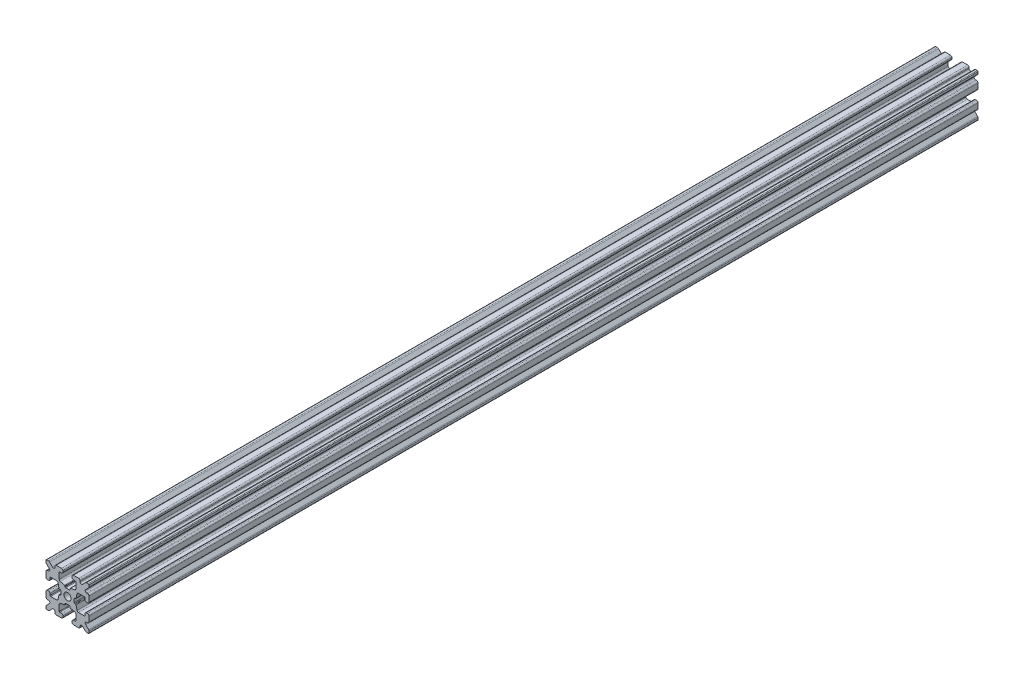
from build123d import *

# Parameters (mm, degrees)
CROQUIS1_R              = 1.25
SALIENTE_EXTRUIR1_DEPTH = 300
CROQUIS2_R              = 1.25
SALIENTE_EXTRUIR2_DEPTH = 40
CROQUIS3_W              = 34.056367391
CROQUIS3_H              = 19.601200986
CORTAR_EXTRUIR1_DEPTH   = 30


with BuildPart() as part:
    # Croquis1 → Saliente-Extruir1 (new body)
    with BuildSketch(Plane(origin=(0, 0, -150), x_dir=(-1, 0, 0), z_dir=(0, 0, -1))):
        with BuildLine():
            Line((-2.9, -5.9), (-2.9, -3.80033659))
            ThreePointArc((-2.9, -3.80033659), (-2.790306203, -3.487828881), (-2.509355728, -3.312441801))
            Line((-2.509355728, -3.312441801), (-0.981757709, -2.970049142))
            ThreePointArc((-0.981757709, -2.970049142), (-0.869377519, -2.89989431), (-0.8255, -2.774891226))
            Line((-0.8255, -2.774891226), (-0.8255, -2.5470646))
            ThreePointArc((-0.8255, -2.5470646), (-0.766921356, -2.405643244), (-0.6255, -2.3470646))
            Line((-0.6255, -2.3470646), (0.6255, -2.3470646))
            ThreePointArc((0.6255, -2.3470646), (0.766921356, -2.405643244), (0.8255, -2.5470646))
            Line((0.8255, -2.5470646), (0.8255, -2.774891226))
            ThreePointArc((0.8255, -2.774891226), (0.869377519, -2.89989431), (0.981757709, -2.970049142))
            Line((0.981757709, -2.970049142), (2.509355728, -3.312441801))
            ThreePointArc((2.509355728, -3.312441801), (2.790306203, -3.487828881), (2.9, -3.80033659))
            Line((2.9, -3.80033659), (2.9, -5.9))
            ThreePointArc((2.9, -5.9), (2.841421356, -6.041421356), (2.7, -6.1))
            Line((2.7, -6.1), (2.1, -6.1))
            ThreePointArc((2.1, -6.1), (1.746446609, -6.246446609), (1.6, -6.6))
            Line((1.6, -6.6), (1.6, -7))
            ThreePointArc((1.6, -7), (1.746446609, -7.353553391), (2.1, -7.5))
            Line((2.1, -7.5), (3.9, -7.5))
            ThreePointArc((3.9, -7.5), (4.253553391, -7.353553391), (4.4, -7))
            Line((4.4, -7), (4.4, -6.667766953))
            ThreePointArc((4.4, -6.667766953), (4.708658284, -6.205827187), (5.253553391, -6.314213562))
            Line((5.253553391, -6.314213562), (6.292893219, -7.353553391))
            ThreePointArc((6.292893219, -7.353553391), (6.455104893, -7.461939766), (6.646446609, -7.5))
            Line((6.646446609, -7.5), (7.25, -7.5))
            ThreePointArc((7.25, -7.5), (7.426776695, -7.426776695), (7.5, -7.25))
            Line((7.5, -7.25), (7.5, -6.646446609))
            ThreePointArc((7.5, -6.646446609), (7.461939766, -6.455104893), (7.353553391, -6.292893219))
            Line((7.353553391, -6.292893219), (6.314213562, -5.253553391))
            ThreePointArc((6.314213562, -5.253553391), (6.205827187, -4.708658284), (6.667766953, -4.4))
            Line((6.667766953, -4.4), (7, -4.4))
            ThreePointArc((7, -4.4), (7.353553391, -4.253553391), (7.5, -3.9))
            Line((7.5, -3.9), (7.5, -2.1))
            ThreePointArc((7.5, -2.1), (7.353553391, -1.746446609), (7, -1.6))
            Line((7, -1.6), (6.6, -1.6))
            ThreePointArc((6.6, -1.6), (6.246446609, -1.746446609), (6.1, -2.1))
            Line((6.1, -2.1), (6.1, -2.7))
            ThreePointArc((6.1, -2.7), (6.041421356, -2.841421356), (5.9, -2.9))
            Line((5.9, -2.9), (3.80033659, -2.9))
            ThreePointArc((3.80033659, -2.9), (3.487828881, -2.790306203), (3.312441801, -2.509355728))
            Line((3.312441801, -2.509355728), (2.970049142, -0.981757709))
            ThreePointArc((2.970049142, -0.981757709), (2.89989431, -0.869377519), (2.774891226, -0.8255))
            Line((2.774891226, -0.8255), (2.5470646, -0.8255))
            ThreePointArc((2.5470646, -0.8255), (2.405643244, -0.766921356), (2.3470646, -0.6255))
            Line((2.3470646, -0.6255), (2.3470646, 0.6255))
            ThreePointArc((2.3470646, 0.6255), (2.405643244, 0.766921356), (2.5470646, 0.8255))
            Line((2.5470646, 0.8255), (2.774891226, 0.8255))
            ThreePointArc((2.774891226, 0.8255), (2.89989431, 0.869377519), (2.970049142, 0.981757709))
            Line((2.970049142, 0.981757709), (3.312441801, 2.509355728))
            ThreePointArc((3.312441801, 2.509355728), (3.487828881, 2.790306203), (3.80033659, 2.9))
            Line((3.80033659, 2.9), (5.9, 2.9))
            ThreePointArc((5.9, 2.9), (6.041421356, 2.841421356), (6.1, 2.7))
            Line((6.1, 2.7), (6.1, 2.1))
            ThreePointArc((6.1, 2.1), (6.246446609, 1.746446609), (6.6, 1.6))
            Line((6.6, 1.6), (7, 1.6))
            ThreePointArc((7, 1.6), (7.353553391, 1.746446609), (7.5, 2.1))
            Line((7.5, 2.1), (7.5, 3.9))
            ThreePointArc((7.5, 3.9), (7.353553391, 4.253553391), (7, 4.4))
            Line((7, 4.4), (6.667766953, 4.4))
            ThreePointArc((6.667766953, 4.4), (6.205827187, 4.708658284), (6.314213562, 5.253553391))
            Line((6.314213562, 5.253553391), (7.353553391, 6.292893219))
            ThreePointArc((7.353553391, 6.292893219), (7.461939766, 6.455104893), (7.5, 6.646446609))
            Line((7.5, 6.646446609), (7.5, 7.25))
            ThreePointArc((7.5, 7.25), (7.426776695, 7.426776695), (7.25, 7.5))
            Line((7.25, 7.5), (6.646446609, 7.5))
            ThreePointArc((6.646446609, 7.5), (6.455104893, 7.461939766), (6.292893219, 7.353553391))
            Line((6.292893219, 7.353553391), (5.253553391, 6.314213562))
            ThreePointArc((5.253553391, 6.314213562), (4.708658284, 6.205827187), (4.4, 6.667766953))
            Line((4.4, 6.667766953), (4.4, 7))
            ThreePointArc((4.4, 7), (4.253553391, 7.353553391), (3.9, 7.5))
            Line((3.9, 7.5), (2.1, 7.5))
            ThreePointArc((2.1, 7.5), (1.746446609, 7.353553391), (1.6, 7))
            Line((1.6, 7), (1.6, 6.6))
            ThreePointArc((1.6, 6.6), (1.746446609, 6.246446609), (2.1, 6.1))
            Line((2.1, 6.1), (2.7, 6.1))
            ThreePointArc((2.7, 6.1), (2.841421356, 6.041421356), (2.9, 5.9))
            Line((2.9, 5.9), (2.9, 3.80033659))
            ThreePointArc((2.9, 3.80033659), (2.790306203, 3.487828881), (2.509355728, 3.312441801))
            Line((2.509355728, 3.312441801), (0.981757709, 2.970049142))
            ThreePointArc((0.981757709, 2.970049142), (0.869377519, 2.89989431), (0.8255, 2.774891226))
            Line((0.8255, 2.774891226), (0.8255, 2.5470646))
            ThreePointArc((0.8255, 2.5470646), (0.766921356, 2.405643244), (0.6255, 2.3470646))
            Line((0.6255, 2.3470646), (-0.6255, 2.3470646))
            ThreePointArc((-0.6255, 2.3470646), (-0.766921356, 2.405643244), (-0.8255, 2.5470646))
            Line((-0.8255, 2.5470646), (-0.8255, 2.774891226))
            ThreePointArc((-0.8255, 2.774891226), (-0.869377519, 2.89989431), (-0.981757709, 2.970049142))
            Line((-0.981757709, 2.970049142), (-2.509355728, 3.312441801))
            ThreePointArc((-2.509355728, 3.312441801), (-2.790306203, 3.487828881), (-2.9, 3.80033659))
            Line((-2.9, 3.80033659), (-2.9, 5.9))
            ThreePointArc((-2.9, 5.9), (-2.841421356, 6.041421356), (-2.7, 6.1))
            Line((-2.7, 6.1), (-2.1, 6.1))
            ThreePointArc((-2.1, 6.1), (-1.746446609, 6.246446609), (-1.6, 6.6))
            Line((-1.6, 6.6), (-1.6, 7))
            ThreePointArc((-1.6, 7), (-1.746446609, 7.353553391), (-2.1, 7.5))
            Line((-2.1, 7.5), (-3.9, 7.5))
            ThreePointArc((-3.9, 7.5), (-4.253553391, 7.353553391), (-4.4, 7))
            Line((-4.4, 7), (-4.4, 6.667766953))
            ThreePointArc((-4.4, 6.667766953), (-4.708658284, 6.205827187), (-5.253553391, 6.314213562))
            Line((-5.253553391, 6.314213562), (-6.292893219, 7.353553391))
            ThreePointArc((-6.292893219, 7.353553391), (-6.455104893, 7.461939766), (-6.646446609, 7.5))
            Line((-6.646446609, 7.5), (-7.25, 7.5))
            ThreePointArc((-7.25, 7.5), (-7.426776695, 7.426776695), (-7.5, 7.25))
            Line((-7.5, 7.25), (-7.5, 6.646446609))
            ThreePointArc((-7.5, 6.646446609), (-7.461939766, 6.455104893), (-7.353553391, 6.292893219))
            Line((-7.353553391, 6.292893219), (-6.314213562, 5.253553391))
            ThreePointArc((-6.314213562, 5.253553391), (-6.205827187, 4.708658284), (-6.667766953, 4.4))
            Line((-6.667766953, 4.4), (-7, 4.4))
            ThreePointArc((-7, 4.4), (-7.353553391, 4.253553391), (-7.5, 3.9))
            Line((-7.5, 3.9), (-7.5, 2.1))
            ThreePointArc((-7.5, 2.1), (-7.353553391, 1.746446609), (-7, 1.6))
            Line((-7, 1.6), (-6.6, 1.6))
            ThreePointArc((-6.6, 1.6), (-6.246446609, 1.746446609), (-6.1, 2.1))
            Line((-6.1, 2.1), (-6.1, 2.7))
            ThreePointArc((-6.1, 2.7), (-6.041421356, 2.841421356), (-5.9, 2.9))
            Line((-5.9, 2.9), (-3.80033659, 2.9))
            ThreePointArc((-3.80033659, 2.9), (-3.487828881, 2.790306203), (-3.312441801, 2.509355728))
            Line((-3.312441801, 2.509355728), (-2.970049142, 0.981757709))
            ThreePointArc((-2.970049142, 0.981757709), (-2.89989431, 0.869377519), (-2.774891226, 0.8255))
            Line((-2.774891226, 0.8255), (-2.5470646, 0.8255))
            ThreePointArc((-2.5470646, 0.8255), (-2.405643244, 0.766921356), (-2.3470646, 0.6255))
            Line((-2.3470646, 0.6255), (-2.3470646, -0.6255))
            ThreePointArc((-2.3470646, -0.6255), (-2.405643244, -0.766921356), (-2.5470646, -0.8255))
            Line((-2.5470646, -0.8255), (-2.774891226, -0.8255))
            ThreePointArc((-2.774891226, -0.8255), (-2.89989431, -0.869377519), (-2.970049142, -0.981757709))
            Line((-2.970049142, -0.981757709), (-3.312441801, -2.509355728))
            ThreePointArc((-3.312441801, -2.509355728), (-3.487828881, -2.790306203), (-3.80033659, -2.9))
            Line((-3.80033659, -2.9), (-5.9, -2.9))
            ThreePointArc((-5.9, -2.9), (-6.041421356, -2.841421356), (-6.1, -2.7))
            Line((-6.1, -2.7), (-6.1, -2.1))
            ThreePointArc((-6.1, -2.1), (-6.246446609, -1.746446609), (-6.6, -1.6))
            Line((-6.6, -1.6), (-7, -1.6))
            ThreePointArc((-7, -1.6), (-7.353553391, -1.746446609), (-7.5, -2.1))
            Line((-7.5, -2.1), (-7.5, -3.9))
            ThreePointArc((-7.5, -3.9), (-7.353553391, -4.253553391), (-7, -4.4))
            Line((-7, -4.4), (-6.667766953, -4.4))
            ThreePointArc((-6.667766953, -4.4), (-6.205827187, -4.708658284), (-6.314213562, -5.253553391))
            Line((-6.314213562, -5.253553391), (-7.353553391, -6.292893219))
            ThreePointArc((-7.353553391, -6.292893219), (-7.461939766, -6.455104893), (-7.5, -6.646446609))
            Line((-7.5, -6.646446609), (-7.5, -7.25))
            ThreePointArc((-7.5, -7.25), (-7.426776695, -7.426776695), (-7.25, -7.5))
            Line((-7.25, -7.5), (-6.646446609, -7.5))
            ThreePointArc((-6.646446609, -7.5), (-6.455104893, -7.461939766), (-6.292893219, -7.353553391))
            Line((-6.292893219, -7.353553391), (-5.253553391, -6.314213562))
            ThreePointArc((-5.253553391, -6.314213562), (-4.708658284, -6.205827187), (-4.4, -6.667766953))
            Line((-4.4, -6.667766953), (-4.4, -7))
            ThreePointArc((-4.4, -7), (-4.253553391, -7.353553391), (-3.9, -7.5))
            Line((-3.9, -7.5), (-2.1, -7.5))
            ThreePointArc((-2.1, -7.5), (-1.746446609, -7.353553391), (-1.6, -7))
            Line((-1.6, -7), (-1.6, -6.6))
            ThreePointArc((-1.6, -6.6), (-1.746446609, -6.246446609), (-2.1, -6.1))
            Line((-2.1, -6.1), (-2.7, -6.1))
            ThreePointArc((-2.7, -6.1), (-2.841421356, -6.041421356), (-2.9, -5.9))
        make_face()
        with Locations(Location((0, 0, 0), (0, 0, 180))):
            Circle(CROQUIS1_R, mode=Mode.SUBTRACT)
    extrude(amount=-SALIENTE_EXTRUIR1_DEPTH)

    # Croquis2 → Saliente-Extruir2 (add)
    with BuildSketch(Plane.XY.offset(150)):
        with BuildLine():
            Line((2.7, -6.1), (2.1, -6.1))
            ThreePointArc((2.1, -6.1), (1.746446609, -6.246446609), (1.6, -6.6))
            Line((1.6, -6.6), (1.6, -7))
            ThreePointArc((1.6, -7), (1.746446609, -7.353553391), (2.1, -7.5))
            Line((2.1, -7.5), (3.9, -7.5))
            ThreePointArc((3.9, -7.5), (4.253553391, -7.353553391), (4.4, -7))
            Line((4.4, -7), (4.4, -6.667766953))
            ThreePointArc((4.4, -6.667766953), (4.708658284, -6.205827187), (5.253553391, -6.314213562))
            Line((5.253553391, -6.314213562), (6.292893219, -7.353553391))
            ThreePointArc((6.292893219, -7.353553391), (6.455104893, -7.461939766), (6.646446609, -7.5))
            Line((6.646446609, -7.5), (7.25, -7.5))
            ThreePointArc((7.25, -7.5), (7.426776695, -7.426776695), (7.5, -7.25))
            Line((7.5, -7.25), (7.5, -6.646446609))
            ThreePointArc((7.5, -6.646446609), (7.461939766, -6.455104893), (7.353553391, -6.292893219))
            Line((7.353553391, -6.292893219), (6.314213562, -5.253553391))
            ThreePointArc((6.314213562, -5.253553391), (6.205827187, -4.708658284), (6.667766953, -4.4))
            Line((6.667766953, -4.4), (7, -4.4))
            ThreePointArc((7, -4.4), (7.353553391, -4.253553391), (7.5, -3.9))
            Line((7.5, -3.9), (7.5, -2.1))
            ThreePointArc((7.5, -2.1), (7.353553391, -1.746446609), (7, -1.6))
            Line((7, -1.6), (6.6, -1.6))
            ThreePointArc((6.6, -1.6), (6.246446609, -1.746446609), (6.1, -2.1))
            Line((6.1, -2.1), (6.1, -2.7))
            ThreePointArc((6.1, -2.7), (6.041421356, -2.841421356), (5.9, -2.9))
            Line((5.9, -2.9), (3.80033659, -2.9))
            ThreePointArc((3.80033659, -2.9), (3.487828881, -2.790306203), (3.312441801, -2.509355728))
            Line((3.312441801, -2.509355728), (2.970049142, -0.981757709))
            ThreePointArc((2.970049142, -0.981757709), (2.89989431, -0.869377519), (2.774891226, -0.8255))
            Line((2.774891226, -0.8255), (2.5470646, -0.8255))
            ThreePointArc((2.5470646, -0.8255), (2.405643244, -0.766921356), (2.3470646, -0.6255))
            Line((2.3470646, -0.6255), (2.3470646, 0.6255))
            ThreePointArc((2.3470646, 0.6255), (2.405643244, 0.766921356), (2.5470646, 0.8255))
            Line((2.5470646, 0.8255), (2.774891226, 0.8255))
            ThreePointArc((2.774891226, 0.8255), (2.89989431, 0.869377519), (2.970049142, 0.981757709))
            Line((2.970049142, 0.981757709), (3.312441801, 2.509355728))
            ThreePointArc((3.312441801, 2.509355728), (3.487828881, 2.790306203), (3.80033659, 2.9))
            Line((3.80033659, 2.9), (5.9, 2.9))
            ThreePointArc((5.9, 2.9), (6.041421356, 2.841421356), (6.1, 2.7))
            Line((6.1, 2.7), (6.1, 2.1))
            ThreePointArc((6.1, 2.1), (6.246446609, 1.746446609), (6.6, 1.6))
            Line((6.6, 1.6), (7, 1.6))
            ThreePointArc((7, 1.6), (7.353553391, 1.746446609), (7.5, 2.1))
            Line((7.5, 2.1), (7.5, 3.9))
            ThreePointArc((7.5, 3.9), (7.353553391, 4.253553391), (7, 4.4))
            Line((7, 4.4), (6.667766953, 4.4))
            ThreePointArc((6.667766953, 4.4), (6.205827187, 4.708658284), (6.314213562, 5.253553391))
            Line((6.314213562, 5.253553391), (7.353553391, 6.292893219))
            ThreePointArc((7.353553391, 6.292893219), (7.461939766, 6.455104893), (7.5, 6.646446609))
            Line((7.5, 6.646446609), (7.5, 7.25))
            ThreePointArc((7.5, 7.25), (7.426776695, 7.426776695), (7.25, 7.5))
            Line((7.25, 7.5), (6.646446609, 7.5))
            ThreePointArc((6.646446609, 7.5), (6.455104893, 7.461939766), (6.292893219, 7.353553391))
            Line((6.292893219, 7.353553391), (5.253553391, 6.314213562))
            ThreePointArc((5.253553391, 6.314213562), (4.708658284, 6.205827187), (4.4, 6.667766953))
            Line((4.4, 6.667766953), (4.4, 7))
            ThreePointArc((4.4, 7), (4.253553391, 7.353553391), (3.9, 7.5))
            Line((3.9, 7.5), (2.1, 7.5))
            ThreePointArc((2.1, 7.5), (1.746446609, 7.353553391), (1.6, 7))
            Line((1.6, 7), (1.6, 6.6))
            ThreePointArc((1.6, 6.6), (1.746446609, 6.246446609), (2.1, 6.1))
            Line((2.1, 6.1), (2.7, 6.1))
            ThreePointArc((2.7, 6.1), (2.841421356, 6.041421356), (2.9, 5.9))
            Line((2.9, 5.9), (2.9, 3.80033659))
            ThreePointArc((2.9, 3.80033659), (2.790306203, 3.487828881), (2.509355728, 3.312441801))
            Line((2.509355728, 3.312441801), (0.981757709, 2.970049142))
            ThreePointArc((0.981757709, 2.970049142), (0.869377519, 2.89989431), (0.8255, 2.774891226))
            Line((0.8255, 2.774891226), (0.8255, 2.5470646))
            ThreePointArc((0.8255, 2.5470646), (0.766921356, 2.405643244), (0.6255, 2.3470646))
            Line((0.6255, 2.3470646), (-0.6255, 2.3470646))
            ThreePointArc((-0.6255, 2.3470646), (-0.766921356, 2.405643244), (-0.8255, 2.5470646))
            Line((-0.8255, 2.5470646), (-0.8255, 2.774891226))
            ThreePointArc((-0.8255, 2.774891226), (-0.869377519, 2.89989431), (-0.981757709, 2.970049142))
            Line((-0.981757709, 2.970049142), (-2.509355728, 3.312441801))
            ThreePointArc((-2.509355728, 3.312441801), (-2.790306203, 3.487828881), (-2.9, 3.80033659))
            Line((-2.9, 3.80033659), (-2.9, 5.9))
            ThreePointArc((-2.9, 5.9), (-2.841421356, 6.041421356), (-2.7, 6.1))
            Line((-2.7, 6.1), (-2.1, 6.1))
            ThreePointArc((-2.1, 6.1), (-1.746446609, 6.246446609), (-1.6, 6.6))
            Line((-1.6, 6.6), (-1.6, 7))
            ThreePointArc((-1.6, 7), (-1.746446609, 7.353553391), (-2.1, 7.5))
            Line((-2.1, 7.5), (-3.9, 7.5))
            ThreePointArc((-3.9, 7.5), (-4.253553391, 7.353553391), (-4.4, 7))
            Line((-4.4, 7), (-4.4, 6.667766953))
            ThreePointArc((-4.4, 6.667766953), (-4.708658284, 6.205827187), (-5.253553391, 6.314213562))
            Line((-5.253553391, 6.314213562), (-6.292893219, 7.353553391))
            ThreePointArc((-6.292893219, 7.353553391), (-6.455104893, 7.461939766), (-6.646446609, 7.5))
            Line((-6.646446609, 7.5), (-7.25, 7.5))
            ThreePointArc((-7.25, 7.5), (-7.426776695, 7.426776695), (-7.5, 7.25))
            Line((-7.5, 7.25), (-7.5, 6.646446609))
            ThreePointArc((-7.5, 6.646446609), (-7.461939766, 6.455104893), (-7.353553391, 6.292893219))
            Line((-7.353553391, 6.292893219), (-6.314213562, 5.253553391))
            ThreePointArc((-6.314213562, 5.253553391), (-6.205827187, 4.708658284), (-6.667766953, 4.4))
            Line((-6.667766953, 4.4), (-7, 4.4))
            ThreePointArc((-7, 4.4), (-7.353553391, 4.253553391), (-7.5, 3.9))
            Line((-7.5, 3.9), (-7.5, 2.1))
            ThreePointArc((-7.5, 2.1), (-7.353553391, 1.746446609), (-7, 1.6))
            Line((-7, 1.6), (-6.6, 1.6))
            ThreePointArc((-6.6, 1.6), (-6.246446609, 1.746446609), (-6.1, 2.1))
            Line((-6.1, 2.1), (-6.1, 2.7))
            ThreePointArc((-6.1, 2.7), (-6.041421356, 2.841421356), (-5.9, 2.9))
            Line((-5.9, 2.9), (-3.80033659, 2.9))
            ThreePointArc((-3.80033659, 2.9), (-3.487828881, 2.790306203), (-3.312441801, 2.509355728))
            Line((-3.312441801, 2.509355728), (-2.970049142, 0.981757709))
            ThreePointArc((-2.970049142, 0.981757709), (-2.89989431, 0.869377519), (-2.774891226, 0.8255))
            Line((-2.774891226, 0.8255), (-2.5470646, 0.8255))
            ThreePointArc((-2.5470646, 0.8255), (-2.405643244, 0.766921356), (-2.3470646, 0.6255))
            Line((-2.3470646, 0.6255), (-2.3470646, -0.6255))
            ThreePointArc((-2.3470646, -0.6255), (-2.405643244, -0.766921356), (-2.5470646, -0.8255))
            Line((-2.5470646, -0.8255), (-2.774891226, -0.8255))
            ThreePointArc((-2.774891226, -0.8255), (-2.89989431, -0.869377519), (-2.970049142, -0.981757709))
            Line((-2.970049142, -0.981757709), (-3.312441801, -2.509355728))
            ThreePointArc((-3.312441801, -2.509355728), (-3.487828881, -2.790306203), (-3.80033659, -2.9))
            Line((-3.80033659, -2.9), (-5.9, -2.9))
            ThreePointArc((-5.9, -2.9), (-6.041421356, -2.841421356), (-6.1, -2.7))
            Line((-6.1, -2.7), (-6.1, -2.1))
            ThreePointArc((-6.1, -2.1), (-6.246446609, -1.746446609), (-6.6, -1.6))
            Line((-6.6, -1.6), (-7, -1.6))
            ThreePointArc((-7, -1.6), (-7.353553391, -1.746446609), (-7.5, -2.1))
            Line((-7.5, -2.1), (-7.5, -3.9))
            ThreePointArc((-7.5, -3.9), (-7.353553391, -4.253553391), (-7, -4.4))
            Line((-7, -4.4), (-6.667766953, -4.4))
            ThreePointArc((-6.667766953, -4.4), (-6.205827187, -4.708658284), (-6.314213562, -5.253553391))
            Line((-6.314213562, -5.253553391), (-7.353553391, -6.292893219))
            ThreePointArc((-7.353553391, -6.292893219), (-7.461939766, -6.455104893), (-7.5, -6.646446609))
            Line((-7.5, -6.646446609), (-7.5, -7.25))
            ThreePointArc((-7.5, -7.25), (-7.426776695, -7.426776695), (-7.25, -7.5))
            Line((-7.25, -7.5), (-6.646446609, -7.5))
            ThreePointArc((-6.646446609, -7.5), (-6.455104893, -7.461939766), (-6.292893219, -7.353553391))
            Line((-6.292893219, -7.353553391), (-5.253553391, -6.314213562))
            ThreePointArc((-5.253553391, -6.314213562), (-4.708658284, -6.205827187), (-4.4, -6.667766953))
            Line((-4.4, -6.667766953), (-4.4, -7))
            ThreePointArc((-4.4, -7), (-4.253553391, -7.353553391), (-3.9, -7.5))
            Line((-3.9, -7.5), (-2.1, -7.5))
            ThreePointArc((-2.1, -7.5), (-1.746446609, -7.353553391), (-1.6, -7))
            Line((-1.6, -7), (-1.6, -6.6))
            ThreePointArc((-1.6, -6.6), (-1.746446609, -6.246446609), (-2.1, -6.1))
            Line((-2.1, -6.1), (-2.7, -6.1))
            ThreePointArc((-2.7, -6.1), (-2.841421356, -6.041421356), (-2.9, -5.9))
            Line((-2.9, -5.9), (-2.9, -3.80033659))
            ThreePointArc((-2.9, -3.80033659), (-2.790306203, -3.487828881), (-2.509355728, -3.312441801))
            Line((-2.509355728, -3.312441801), (-0.981757709, -2.970049142))
            ThreePointArc((-0.981757709, -2.970049142), (-0.869377519, -2.89989431), (-0.8255, -2.774891226))
            Line((-0.8255, -2.774891226), (-0.8255, -2.5470646))
            ThreePointArc((-0.8255, -2.5470646), (-0.766921356, -2.405643244), (-0.6255, -2.3470646))
            Line((-0.6255, -2.3470646), (0.6255, -2.3470646))
            ThreePointArc((0.6255, -2.3470646), (0.766921356, -2.405643244), (0.8255, -2.5470646))
            Line((0.8255, -2.5470646), (0.8255, -2.774891226))
            ThreePointArc((0.8255, -2.774891226), (0.869377519, -2.89989431), (0.981757709, -2.970049142))
            Line((0.981757709, -2.970049142), (2.509355728, -3.312441801))
            ThreePointArc((2.509355728, -3.312441801), (2.790306203, -3.487828881), (2.9, -3.80033659))
            Line((2.9, -3.80033659), (2.9, -5.9))
            ThreePointArc((2.9, -5.9), (2.841421356, -6.041421356), (2.7, -6.1))
        make_face()
        Circle(CROQUIS2_R, mode=Mode.SUBTRACT)
    extrude(amount=SALIENTE_EXTRUIR2_DEPTH)

    # Croquis3 → Cortar-Extruir1 (cut)
    with BuildSketch(Plane.XY.offset(190)):
        with Locations((1.212689544, -0.675605785)):
            Rectangle(CROQUIS3_W, CROQUIS3_H)
    extrude(amount=-CORTAR_EXTRUIR1_DEPTH, mode=Mode.SUBTRACT)


solid = part.part
